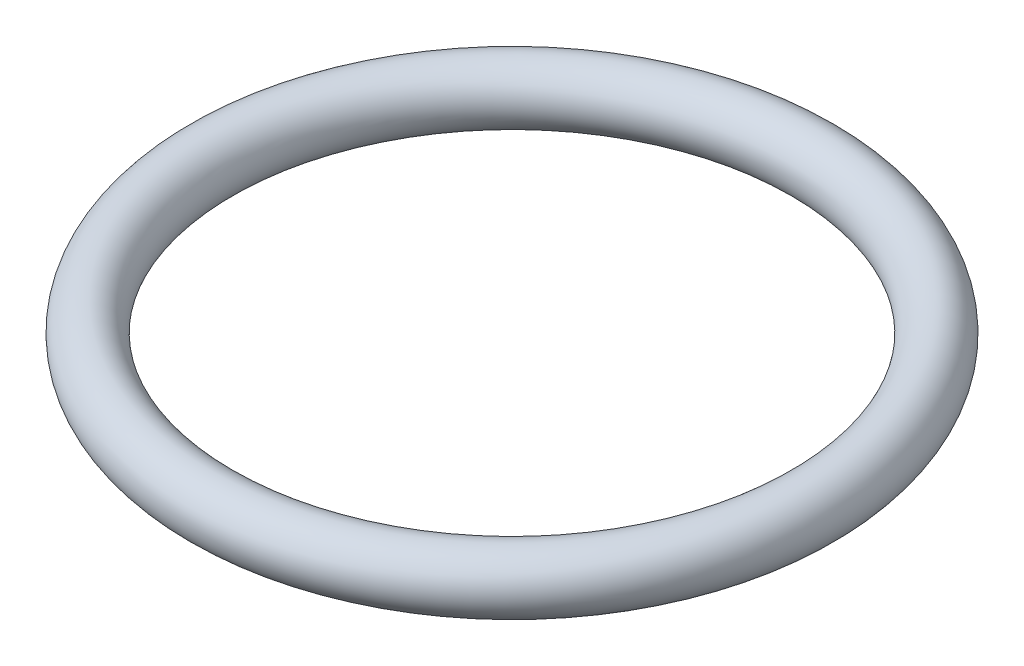
from build123d import *

# Parameters (mm, degrees)
SKETCH1_R = 1


with BuildPart() as part:
    # Sketch1 → Revolve1 (revolve)
    with BuildSketch(Plane.XY):
        with Locations((-10.2, 0)):
            Circle(SKETCH1_R)
    revolve(axis=Axis((0, 14.080317926, 0), (0, -1, 0)))


solid = part.part
